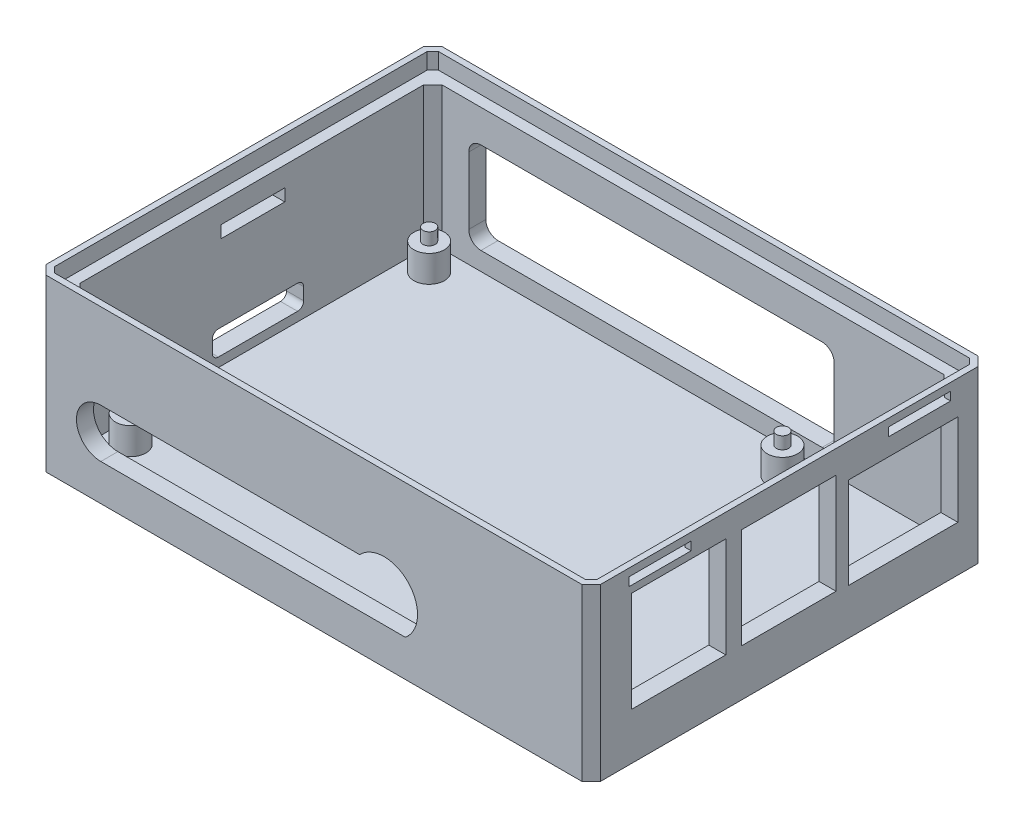
from build123d import *

# Parameters (mm, degrees)
SKETCH1_W           = 91
SKETCH1_H           = 65
BOSS_EXTRUDE1_DEPTH = 2
SKETCH2_R           = 2.5
BOSS_EXTRUDE2_DEPTH = 4.4
SKETCH3_R           = 1
BOSS_EXTRUDE3_DEPTH = 2
SKETCH4_W           = 91
SKETCH4_H           = 28
BOSS_EXTRUDE4_DEPTH = 2.8
SKETCH5_W           = 65
SKETCH5_H           = 28
SKETCH5_W_2         = 15.5
SKETCH5_H_2         = 16.5
SKETCH5_W_3         = 18
SKETCH5_H_3         = 15
BOSS_EXTRUDE5_DEPTH = 2.8
SKETCH6_W           = 91
SKETCH6_H           = 28
BOSS_EXTRUDE6_DEPTH = 2.8
SKETCH7_W           = 65
SKETCH7_H           = 28
BOSS_EXTRUDE7_DEPTH = 2.8
CHAMFER1_SIZE       = 1.5
CUT_EXTRUDE1_DEPTH  = 2.65
SKETCH11_W          = 10.5
SKETCH11_H          = 2
CUT_EXTRUDE2_DEPTH  = 3
SKETCH12_W          = 10.2
SKETCH12_H          = 1.4
CUT_EXTRUDE3_DEPTH  = 3


with BuildPart() as part:
    # Sketch1 → Boss-Extrude1 (new body)
    with BuildSketch(Plane(origin=(0, 0, 0), x_dir=(1, 0, 0), z_dir=(0, 1, 0))):
        Rectangle(SKETCH1_W, SKETCH1_H)
    extrude(amount=BOSS_EXTRUDE1_DEPTH)

    # Sketch2 → Boss-Extrude2 (add)
    with BuildSketch(Plane(origin=(0, 2, 0), x_dir=(1, 0, 0), z_dir=(0, 1, 0))):
        with Locations(Location((-39, -23.6, 0), (0, 0, 90))):
            Circle(SKETCH2_R)
        with Locations(Location((-39, 25.4, 0), (0, 0, 90))):
            Circle(SKETCH2_R)
        with Locations(Location((19, 25.4, 0), (0, 0, 90))):
            Circle(SKETCH2_R)
        with Locations(Location((19, -23.6, 0), (0, 0, 90))):
            Circle(SKETCH2_R)
    extrude(amount=BOSS_EXTRUDE2_DEPTH)

    # Sketch3 → Boss-Extrude3 (add)
    with BuildSketch(Plane(origin=(0, 6.4, 0), x_dir=(1, 0, 0), z_dir=(0, 1, 0))):
        with Locations(Location((-39, -23.6, 0), (0, 0, 270))):
            Circle(SKETCH3_R)
        with Locations(Location((-39, 25.4, 0), (0, 0, 270))):
            Circle(SKETCH3_R)
        with Locations(Location((19, 25.4, 0), (0, 0, 270))):
            Circle(SKETCH3_R)
        with Locations(Location((19, -23.6, 0), (0, 0, 270))):
            Circle(SKETCH3_R)
    extrude(amount=BOSS_EXTRUDE3_DEPTH)

    # Sketch4 → Boss-Extrude4 (add)
    with BuildSketch(Plane.XY.offset(32.5)):
        with Locations((0, 14)):
            Rectangle(SKETCH4_W, SKETCH4_H)
        with BuildLine():
            Line((-35, 14), (7.5, 14))
            ThreePointArc((7.5, 14), (15.507804885, 13.99169208), (15, 6))
            Line((15, 6), (-35, 6))
            ThreePointArc((-35, 6), (-39, 10), (-35, 14))
        make_face(mode=Mode.SUBTRACT)
    extrude(amount=-BOSS_EXTRUDE4_DEPTH)

    # Sketch5 → Boss-Extrude5 (add)
    with BuildSketch(Plane(origin=(45.5, 0, 0), x_dir=(0, 0, -1), z_dir=(1, 0, 0))):
        with Locations((0, 14)):
            Rectangle(SKETCH5_W, SKETCH5_H)
        with Locations((-18.15, 15.95)):
            Rectangle(SKETCH5_W_2, SKETCH5_H_2, mode=Mode.SUBTRACT)
        with Locations((-0.05, 15.95)):
            Rectangle(SKETCH5_W_2, SKETCH5_H_2, mode=Mode.SUBTRACT)
        with Locations((18.7, 15)):
            Rectangle(SKETCH5_W_3, SKETCH5_H_3, mode=Mode.SUBTRACT)
    extrude(amount=-BOSS_EXTRUDE5_DEPTH)

    # Sketch6 → Boss-Extrude6 (add)
    with BuildSketch(Plane(origin=(0, 0, -32.5), x_dir=(-1, 0, 0), z_dir=(0, 0, -1))):
        with Locations((0, 14)):
            Rectangle(SKETCH6_W, SKETCH6_H)
        with BuildLine():
            Line((-21.2, 20), (34.8, 20))
            ThreePointArc((34.8, 20), (36.214213562, 19.414213562), (36.8, 18))
            Line((36.8, 18), (36.8, 7))
            ThreePointArc((36.8, 7), (36.214213562, 5.585786438), (34.8, 5))
            Line((34.8, 5), (-21.2, 5))
            ThreePointArc((-21.2, 5), (-22.614213562, 5.585786438), (-23.2, 7))
            Line((-23.2, 7), (-23.2, 18))
            ThreePointArc((-23.2, 18), (-22.614213562, 19.414213562), (-21.2, 20))
        make_face(mode=Mode.SUBTRACT)
    extrude(amount=-BOSS_EXTRUDE6_DEPTH)

    # Sketch7 → Boss-Extrude7 (add)
    with BuildSketch(Plane.ZY.offset(45.5)):
        with Locations((0, 14)):
            Rectangle(SKETCH7_W, SKETCH7_H)
        with BuildLine():
            Line((-7.5, 3.5), (5.5, 3.5))
            ThreePointArc((5.5, 3.5), (6.207106781, 3.792893219), (6.5, 4.5))
            Line((6.5, 4.5), (6.5, 6.5))
            ThreePointArc((6.5, 6.5), (6.207106781, 7.207106781), (5.5, 7.5))
            Line((5.5, 7.5), (-7.5, 7.5))
            ThreePointArc((-7.5, 7.5), (-8.207106781, 7.207106781), (-8.5, 6.5))
            Line((-8.5, 6.5), (-8.5, 4.5))
            ThreePointArc((-8.5, 4.5), (-8.207106781, 3.792893219), (-7.5, 3.5))
        make_face(mode=Mode.SUBTRACT)
    extrude(amount=-BOSS_EXTRUDE7_DEPTH)

    # Chamfer1
    chamfer1_edges = [part.edges().sort_by_distance(p)[0] for p in [
        (42.7, 15, -29.7),
        (-42.7, 15, -29.7),
        (-42.7, 15, 29.7),
        (45.5, 14, 32.5),
        (-45.5, 14, 32.5),
        (-45.5, 14, -32.5),
        (45.5, 14, -32.5),
        (42.7, 15, 29.7),
    ]]
    chamfer(chamfer1_edges, length=CHAMFER1_SIZE)

    # Sketch8 → Cut-Extrude1 (cut)
    with BuildSketch(Plane(origin=(0, 28, 0), x_dir=(1, 0, 0), z_dir=(0, 1, 0))):
        Polygon((43.585786438, 31.5), (-43.585786438, 31.5), (-44.5, 30.585786438), (-44.5, -30.585786438), (-43.585786438, -31.5), (43.585786438, -31.5), (44.5, -30.585786438), (44.5, 30.585786438), align=None)
    extrude(amount=-CUT_EXTRUDE1_DEPTH, mode=Mode.SUBTRACT)

    # Sketch11 → Cut-Extrude2 (cut)
    with BuildSketch(Plane(origin=(-42.7, 0, 0), x_dir=(0, 0, -1), z_dir=(1, 0, 0))):
        with Locations((0.15, 21.1)):
            Rectangle(SKETCH11_W, SKETCH11_H)
    extrude(amount=-CUT_EXTRUDE2_DEPTH, mode=Mode.SUBTRACT)

    # Sketch12 → Cut-Extrude3 (cut)
    with BuildSketch(Plane(origin=(45.5, 0, 0), x_dir=(0, 0, -1), z_dir=(1, 0, 0))):
        with Locations((-21.2, 26.05)):
            Rectangle(SKETCH12_W, SKETCH12_H)
        with Locations((21.4, 26.05)):
            Rectangle(SKETCH12_W, SKETCH12_H)
    extrude(amount=-CUT_EXTRUDE3_DEPTH, mode=Mode.SUBTRACT)


solid = part.part
